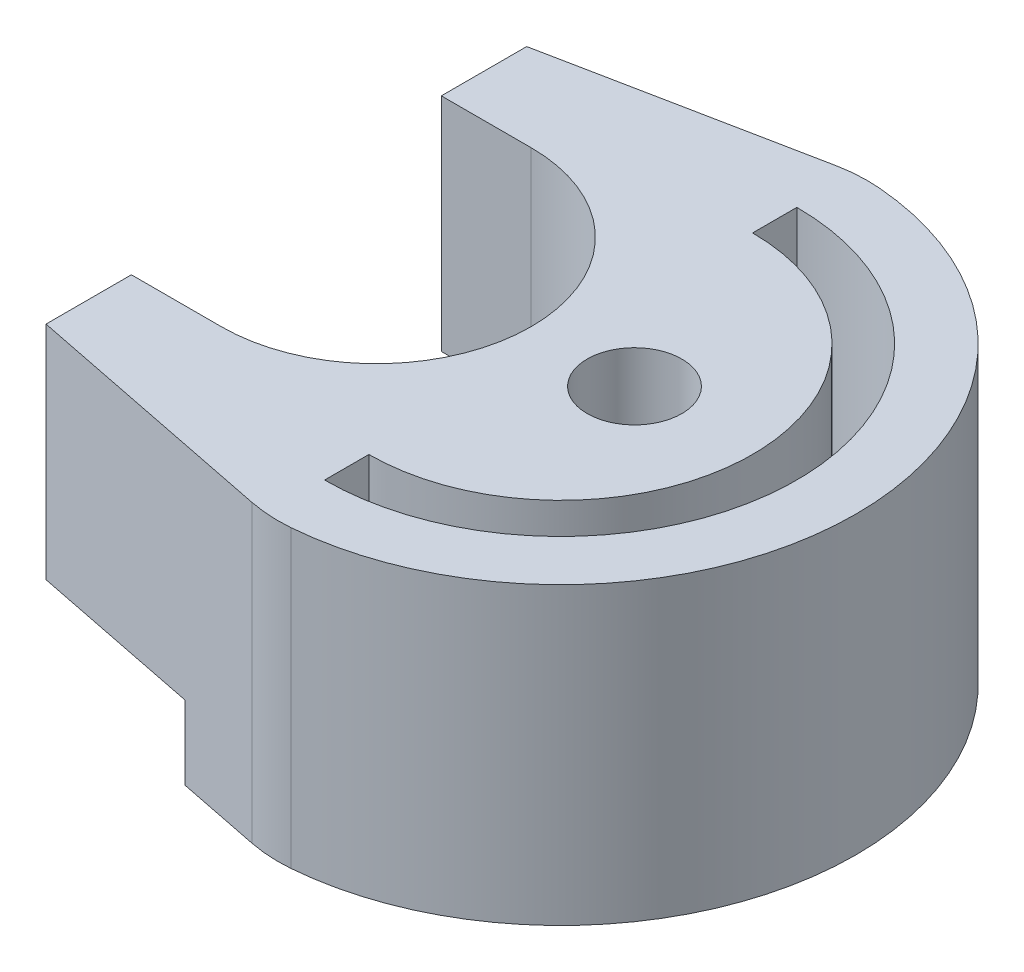
from build123d import *

# Parameters (mm, degrees)
SKETCH1_R           = 0.3207
BOSS_EXTRUDE4_DEPTH = 2
BOSS_EXTRUDE5_START = 0.5
BOSS_EXTRUDE5_DEPTH = 1.5


with BuildPart() as part:
    # Sketch1 → Boss-Extrude4 (new body)
    with BuildSketch(Plane(origin=(0, 0, 0), x_dir=(1, 0, 0), z_dir=(0, 1, 0))):
        with BuildLine():
            ThreePointArc((0.164100899, 1.993256355), (0.024548564, 1.994973575), (-0.11388376, 1.977245221))
            Line((-0.11388376, 1.977245221), (-0.68194188, 1.863743198))
            Line((-0.68194188, 1.863743198), (-0.68194188, 1.25))
            Line((-0.68194188, 1.25), (-0.68194188, 1.113467544))
            ThreePointArc((-0.68194188, 1.113467544), (-0.184032681, 0.652850423), (0, 0))
            ThreePointArc((0, 0), (-0.184032681, -0.652850423), (-0.68194188, -1.113467544))
            Line((-0.68194188, -1.113467544), (-0.68194188, -1.25))
            Line((-0.68194188, -1.25), (-0.68194188, -1.863743197))
            Line((-0.68194188, -1.863743197), (-0.11388376, -1.977245221))
            ThreePointArc((-0.11388376, -1.977245221), (0.024548564, -1.994973575), (0.164100898, -1.993256355))
            ThreePointArc((0.164100898, -1.993256355), (2, 0), (0.164100899, 1.993256355))
        make_face()
        with Locations((0.5, 0)):
            Circle(SKETCH1_R, mode=Mode.SUBTRACT)
        with BuildLine():
            Line((0, 1.3), (0, 1.6))
            ThreePointArc((0, 1.6), (1.6, 0), (0, -1.6))
            Line((0, -1.6), (0, -1.3))
            ThreePointArc((0, -1.3), (1.3, 0), (0, 1.3))
        make_face(mode=Mode.SUBTRACT)
    extrude(amount=BOSS_EXTRUDE4_DEPTH)

    # Sketch1<30> → Boss-Extrude5 (add)
    with BuildSketch(Plane(origin=(0, 0, 0), x_dir=(1, 0, 0), z_dir=(0, 1, 0)).offset(BOSS_EXTRUDE5_START)):
        with BuildLine():
            Line((-0.68194188, 1.863743198), (-1.85903885, 1.628550912))
            Line((-1.85903885, 1.628550912), (-1.85903885, 1.05))
            Line((-1.85903885, 1.05), (-1.25, 1.05))
            ThreePointArc((-1.25, 1.05), (-0.2, 0), (-1.25, -1.05))
            Line((-1.25, -1.05), (-1.85903885, -1.05))
            Line((-1.85903885, -1.05), (-1.85903885, -1.628550912))
            Line((-1.85903885, -1.628550912), (-0.68194188, -1.863743197))
            Line((-0.68194188, -1.863743197), (-0.68194188, -1.113467544))
            ThreePointArc((-0.68194188, -1.113467544), (0, 0), (-0.68194188, 1.113467544))
            Line((-0.68194188, 1.113467544), (-0.68194188, 1.863743198))
        make_face()
    extrude(amount=BOSS_EXTRUDE5_DEPTH)


solid = part.part
